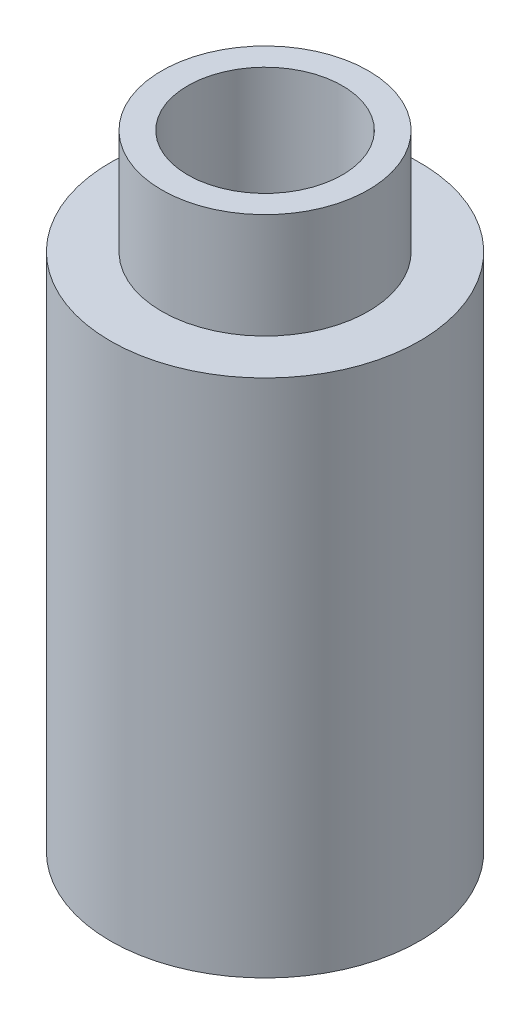
from build123d import *

# Parameters (mm, degrees)
SKETCH1_R           = 9.4488
BOSS_EXTRUDE1_DEPTH = 31.75
SKETCH2_R           = 6.3119
BOSS_EXTRUDE2_DEPTH = 6.4262
SKETCH3_R           = 4.7244
CUT_EXTRUDE1_DEPTH  = 41.447272953


with BuildPart() as part:
    # Sketch1 → Boss-Extrude1 (new body)
    with BuildSketch(Plane(origin=(0, 0, 0), x_dir=(1, 0, 0), z_dir=(0, 1, 0))):
        with Locations(Location((0, 0, 0), (0, 0, 270))):
            Circle(SKETCH1_R)
    extrude(amount=BOSS_EXTRUDE1_DEPTH)

    # Sketch2 → Boss-Extrude2 (add)
    with BuildSketch(Plane(origin=(0, 31.75, 0), x_dir=(1, 0, 0), z_dir=(0, 1, 0))):
        with Locations(Location((0, 0, 0), (0, 0, 270))):
            Circle(SKETCH2_R)
    extrude(amount=BOSS_EXTRUDE2_DEPTH)

    # Sketch3 → Cut-Extrude1 (cut, through all)
    with BuildSketch(Plane(origin=(0, 38.1762, 0), x_dir=(1, 0, 0), z_dir=(0, 1, 0))):
        with Locations(Location((0, 0, 0), (0, 0, 270))):
            Circle(SKETCH3_R)
    extrude(amount=-CUT_EXTRUDE1_DEPTH, mode=Mode.SUBTRACT)


solid = part.part
